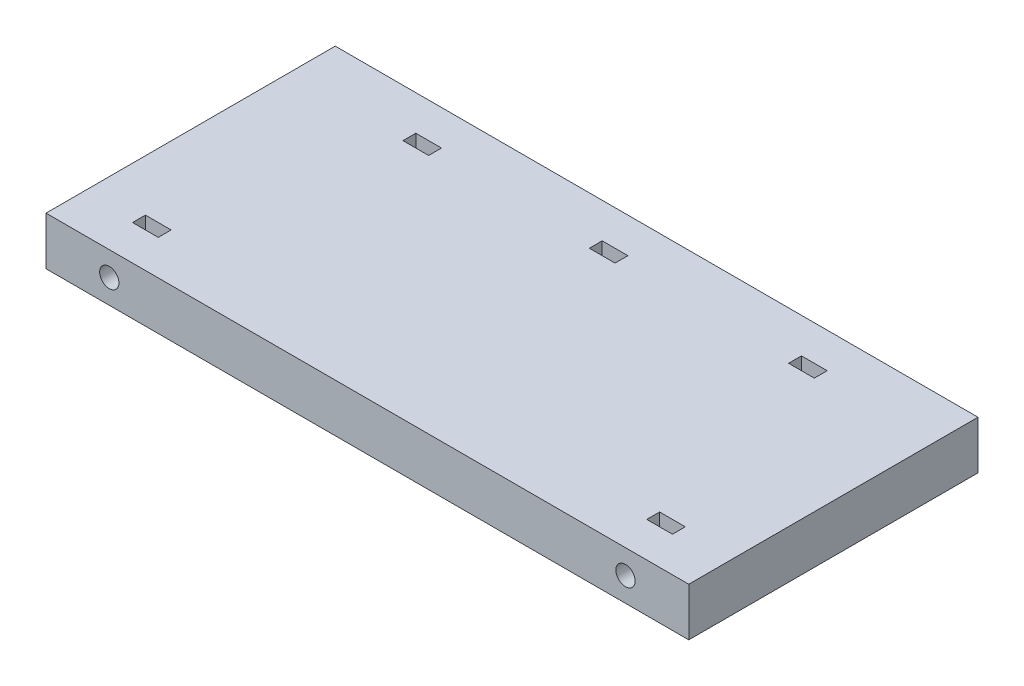
from build123d import *

# Parameters (mm, degrees)
SKETCH1_W           = 200
SKETCH1_H           = 90
SKETCH1_W_2         = 8
SKETCH1_H_2         = 4
BOSS_EXTRUDE1_DEPTH = 15
SKETCH2_R           = 3
CUT_EXTRUDE1_DEPTH  = 20
SKETCH3_R           = 3
CUT_EXTRUDE2_DEPTH  = 20


with BuildPart() as part:
    # Sketch1 → Boss-Extrude1 (new body)
    with BuildSketch(Plane(origin=(0, 0, 0), x_dir=(1, 0, 0), z_dir=(0, 1, 0))):
        with Locations((-5.131403118, 11.792873051)):
            Rectangle(SKETCH1_W, SKETCH1_H)
        with Locations((54.868596882, 43.860843617)):
            Rectangle(SKETCH1_W_2, SKETCH1_H_2, mode=Mode.SUBTRACT)
        with Locations((-65.131403118, 43.860843617)):
            Rectangle(SKETCH1_W_2, SKETCH1_H_2, mode=Mode.SUBTRACT)
        with Locations((-7.131403118, 43.860843617)):
            Rectangle(SKETCH1_W_2, SKETCH1_H_2, mode=Mode.SUBTRACT)
        with Locations((74.868596882, -20.275097514)):
            Rectangle(SKETCH1_W_2, SKETCH1_H_2, mode=Mode.SUBTRACT)
        with Locations((-85.131403118, -20.275097514)):
            Rectangle(SKETCH1_W_2, SKETCH1_H_2, mode=Mode.SUBTRACT)
    extrude(amount=BOSS_EXTRUDE1_DEPTH)

    # Sketch2 → Cut-Extrude1 (cut)
    with BuildSketch(Plane(origin=(0, 0, -56.792873051), x_dir=(-1, 0, 0), z_dir=(0, 0, -1))):
        with Locations((-54.868596882, 7.5)):
            Circle(SKETCH2_R)
        with Locations((5.131403118, 7.5)):
            Circle(SKETCH2_R)
        with Locations(Location((65.131403118, 7.5, 0), (0, 0, 180))):
            Circle(SKETCH2_R)
    extrude(amount=-CUT_EXTRUDE1_DEPTH, mode=Mode.SUBTRACT)

    # Sketch3 → Cut-Extrude2 (cut)
    with BuildSketch(Plane.XY.offset(33.207126949)):
        with Locations((-85.445029849, 7.5)):
            Circle(SKETCH3_R)
        with Locations((75.182223613, 7.5)):
            Circle(SKETCH3_R)
    extrude(amount=-CUT_EXTRUDE2_DEPTH, mode=Mode.SUBTRACT)


solid = part.part
